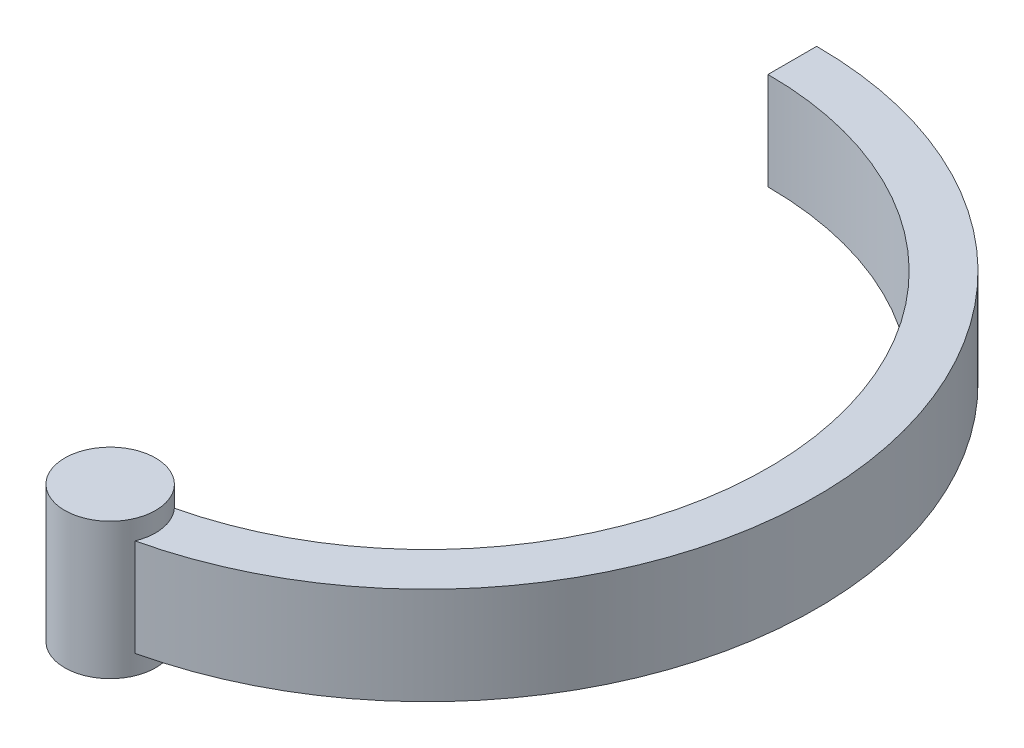
from build123d import *

# Parameters (mm, degrees)
EXTRUDE_2_DEPTH      = 7
EXTRUDE_2_DEPTH_BACK = 7
SKETCH_2_R           = 4.665046409
EXTRUDE_3_DEPTH      = 5
EXTRUDE_3_DEPTH_BACK = 5


with BuildPart() as part:
    # Эскиз2 → Бобышка-Вытянуть2 (new, two sides: drawn at the far end of the back side and taken through both)
    with BuildSketch(Plane(origin=(0, 0, 0), x_dir=(1, 0, 0), z_dir=(0, 1, 0)).offset(-EXTRUDE_2_DEPTH_BACK)):
        with Locations((4.665046409, -37.208699816)):
            Circle(SKETCH_2_R)
    extrude(amount=EXTRUDE_2_DEPTH + EXTRUDE_2_DEPTH_BACK)

    # Эскиз1 → Бобышка-Вытянуть3 (add, two sides: drawn at the far end of the back side and taken through both)
    with BuildSketch(Plane(origin=(0, 0, 0), x_dir=(1, 0, 0), z_dir=(0, 1, 0)).offset(-EXTRUDE_3_DEPTH_BACK)):
        with BuildLine():
            Line((0, 35), (0, 40))
            ThreePointArc((0, 40), (39.743847013, 4.519582352), (8.981279477, -38.978668768))
            ThreePointArc((8.981279477, -38.978668768), (9.256967162, -36.385947248), (8.098232861, -34.050236776))
            ThreePointArc((8.098232861, -34.050236776), (34.761748281, 4.076868457), (0, 35))
        make_face()
    extrude(amount=EXTRUDE_3_DEPTH + EXTRUDE_3_DEPTH_BACK)


solid = part.part
